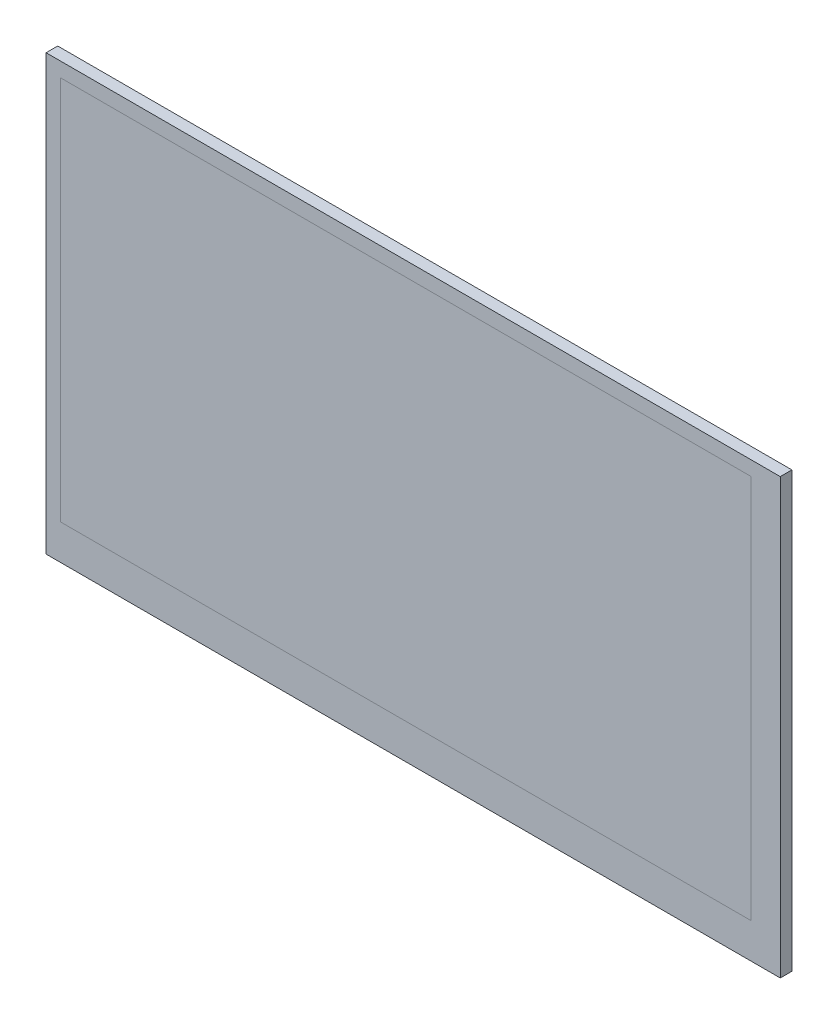
from build123d import *

# Parameters (mm, degrees)
SKETCH1_W           = 164
SKETCH1_H           = 97
BOSS_EXTRUDE1_DEPTH = 2.6
SKETCH2_W           = 154.21
SKETCH2_H           = 85.92
CUT_EXTRUDE1_DEPTH  = 1
BOSS_EXTRUDE3_REACH = 97.305
SKETCH3_W           = 154.21
SKETCH3_H           = 85.92


with BuildPart() as part:
    # Sketch1 → Boss-Extrude1 (new body)
    with BuildSketch(Plane.XY):
        Rectangle(SKETCH1_W, SKETCH1_H)
    extrude(amount=BOSS_EXTRUDE1_DEPTH)

    # Sketch2 → Cut-Extrude1 (cut)
    with BuildSketch(Plane.XY.offset(2.6)):
        with Locations((-1.695, 2.3)):
            Rectangle(SKETCH2_W, SKETCH2_H)
    extrude(amount=-CUT_EXTRUDE1_DEPTH, mode=Mode.SUBTRACT)


with BuildPart() as body_2:

    # Sketch3 → Boss-Extrude3 (new, up to next)
    with BuildSketch(Plane.XY.offset(2.6), mode=Mode.PRIVATE) as boss_extrude3_sk1:
        with Locations((-1.695, 2.3)):
            Rectangle(SKETCH3_W, SKETCH3_H)
    boss_extrude3_tool1 = extrude(boss_extrude3_sk1.sketch, amount=-BOSS_EXTRUDE3_REACH, mode=Mode.PRIVATE) - part.part
    add(boss_extrude3_tool1.solids().sort_by_distance((-1.695, 2.3, 2.6))[0])


solid = Compound([part.part, body_2.part])
